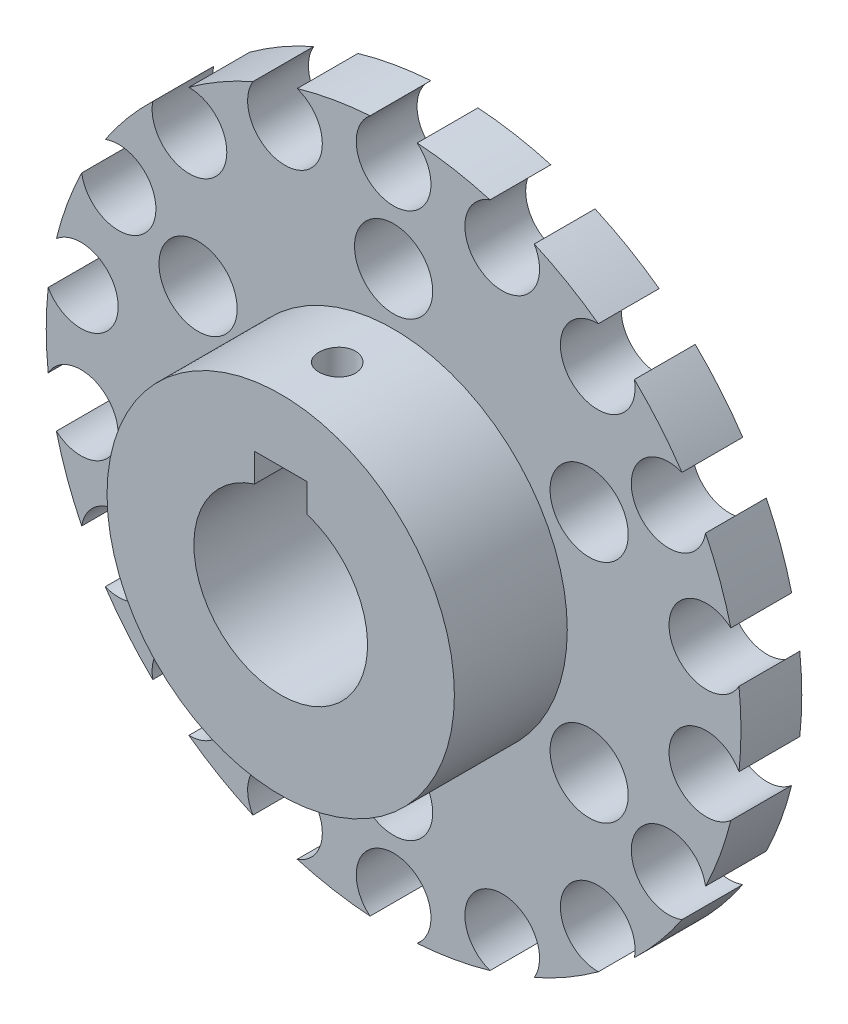
from build123d import *

# Parameters (mm, degrees)
SKETCH_1_R          = 40
EXTRUDE_1_DEPTH     = 7
SKETCH_2_R          = 20
EXTRUDE_2_DEPTH     = 13
SKETCH_3_R          = 4.3
CUT_EXTRUDE_1_DEPTH = 61
SKETCH_4_R          = 4.5
CUT_EXTRUDE_2_DEPTH = 60.938740302
SKETCH_5_R          = 10
CUT_EXTRUDE_3_DEPTH = 60.938740302
SKETCH_6_W          = 6
SKETCH_6_H          = 12.8
CUT_EXTRUDE_4_DEPTH = 60.938740302
SKETCH_8_R          = 2.1
CUT_EXTRUDE_6_DEPTH = 10


with BuildPart() as part:
    # 草图1 → 凸台-拉伸1 (new body)
    with BuildSketch(Plane.XY):
        Circle(SKETCH_1_R)
    extrude(amount=EXTRUDE_1_DEPTH)

    # 草图2 → 凸台-拉伸2 (add)
    with BuildSketch(Plane.XY.offset(7)):
        with Locations(Location((0, 0, 0), (0, 0, 180))):
            Circle(SKETCH_2_R)
    extrude(amount=EXTRUDE_2_DEPTH)

    # 草图3 → 切除-拉伸1 (cut, through all)
    with BuildSketch(Plane.XY):
        with Locations((0, 36.57)):
            Circle(SKETCH_3_R)
        with Locations((-12.507677, 34.364559)):
            Circle(SKETCH_3_R)
        with Locations((-23.506743, 28.014245)):
            Circle(SKETCH_3_R)
        with Locations((-31.670549, 18.285)):
            Circle(SKETCH_3_R)
        with Locations((-36.01442, 6.350314)):
            Circle(SKETCH_3_R)
        with Locations((-36.01442, -6.350314)):
            Circle(SKETCH_3_R)
        with Locations((-31.670549, -18.285)):
            Circle(SKETCH_3_R)
        with Locations((-23.506743, -28.014245)):
            Circle(SKETCH_3_R)
        with Locations((-12.507677, -34.364559)):
            Circle(SKETCH_3_R)
        with Locations((0, -36.57)):
            Circle(SKETCH_3_R)
        with Locations((12.507677, -34.364559)):
            Circle(SKETCH_3_R)
        with Locations((23.506743, -28.014245)):
            Circle(SKETCH_3_R)
        with Locations((31.670549, -18.285)):
            Circle(SKETCH_3_R)
        with Locations((36.01442, -6.350314)):
            Circle(SKETCH_3_R)
        with Locations((36.01442, 6.350314)):
            Circle(SKETCH_3_R)
        with Locations((31.670549, 18.285)):
            Circle(SKETCH_3_R)
        with Locations((23.506743, 28.014245)):
            Circle(SKETCH_3_R)
        with Locations((12.507677, 34.364559)):
            Circle(SKETCH_3_R)
    extrude(amount=CUT_EXTRUDE_1_DEPTH, mode=Mode.SUBTRACT)

    # 草图4 → 切除-拉伸2 (cut, through all)
    with BuildSketch(Plane.XY):
        with Locations((0, 26)):
            Circle(SKETCH_4_R)
        with Locations((-22.51666, 13)):
            Circle(SKETCH_4_R)
        with Locations((-22.51666, -13)):
            Circle(SKETCH_4_R)
        with Locations((0, -26)):
            Circle(SKETCH_4_R)
        with Locations((22.51666, -13)):
            Circle(SKETCH_4_R)
        with Locations((22.51666, 13)):
            Circle(SKETCH_4_R)
    extrude(amount=CUT_EXTRUDE_2_DEPTH, mode=Mode.SUBTRACT)

    # 草图5 → 切除-拉伸3 (cut, through all)
    with BuildSketch(Plane.XY):
        Circle(SKETCH_5_R)
    extrude(amount=CUT_EXTRUDE_3_DEPTH, mode=Mode.SUBTRACT)

    # 草图6 → 切除-拉伸4 (cut, through all)
    with BuildSketch(Plane.XY):
        with Locations((0, 6.4)):
            Rectangle(SKETCH_6_W, SKETCH_6_H)
    extrude(amount=CUT_EXTRUDE_4_DEPTH, mode=Mode.SUBTRACT)

    # 草图8 → 切除-拉伸6 (cut, symmetric)
    with BuildSketch(Plane(origin=(0, 13.5, 0), x_dir=(1, 0, 0), z_dir=(0, 1, 0))):
        with Locations(Location((0, -13.5, 0), (0, 0, 270))):
            Circle(SKETCH_8_R)
    extrude(amount=CUT_EXTRUDE_6_DEPTH, both=True, mode=Mode.SUBTRACT)


solid = part.part
